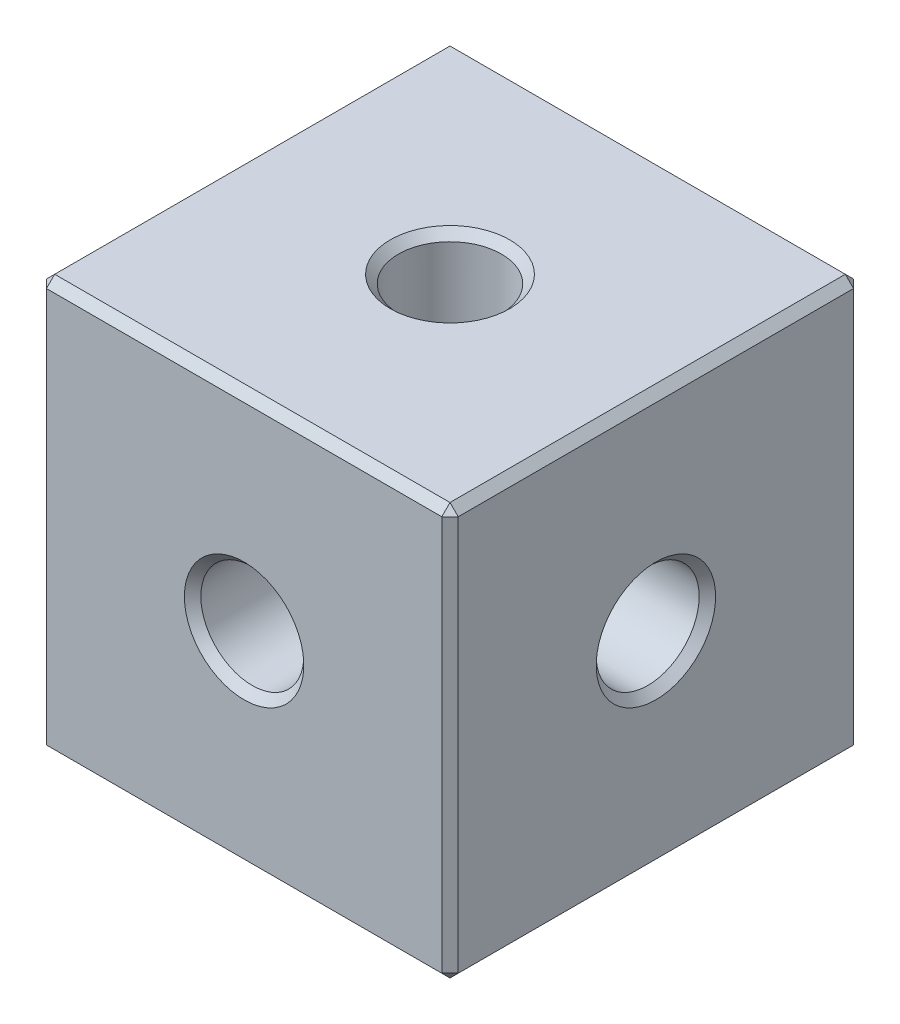
from build123d import *

# Parameters (mm, degrees)
SKETCH_1_W         = 10
SKETCH_1_H         = 10
EXTRUDE_1_DEPTH    = 5
HOLE_WIZARD_M3_1_D = 2.5
HOLE_WIZARD_M3_2_D = 2.5
HOLE_WIZARD_M3_3_D = 2.5
CHAMFER_1_SIZE     = 0.2


with BuildPart() as part:
    # 草图1 → 凸台-拉伸1 (new, symmetric)
    with BuildSketch(Plane(origin=(0, 0, 0), x_dir=(1, 0, 0), z_dir=(0, 1, 0))):
        Rectangle(SKETCH_1_W, SKETCH_1_H)
    extrude(amount=EXTRUDE_1_DEPTH, both=True)

    # M3 螺纹孔1 (through all)
    with Locations(Plane.XY.offset(5)):
        with Locations((0, 0)):
            Hole(HOLE_WIZARD_M3_1_D / 2)

    # M3 螺纹孔2 (through all)
    with Locations(Plane(origin=(0, 5, 0), x_dir=(1, 0, 0), z_dir=(0, 1, 0))):
        with Locations((0, 0)):
            Hole(HOLE_WIZARD_M3_2_D / 2)

    # M3 螺纹孔3 (through all)
    with Locations(Plane(origin=(5, 0, 0), x_dir=(0, 0, -1), z_dir=(1, 0, 0))):
        with Locations((0, 0)):
            Hole(HOLE_WIZARD_M3_3_D / 2)

    # 倒角1
    chamfer_1_edges = [part.edges().sort_by_distance(p)[0] for p in [
        (-5, 5, 0),
        (1.25, 0, 5),
        (1.25, 0, -5),
        (0, 5, 5),
        (1.25, -5, 0),
        (1.25, 5, 0),
        (-5, 0, -1.25),
        (5, 0, -1.25),
        (5, 5, 0),
        (0, -5, 5),
        (-5, -5, 0),
        (0, -5, -5),
        (5, -5, 0),
        (5, 0, 5),
        (-5, 0, 5),
        (-5, 0, -5),
        (5, 0, -5),
        (0, 5, -5),
    ]]
    chamfer(chamfer_1_edges, length=CHAMFER_1_SIZE)


solid = part.part
